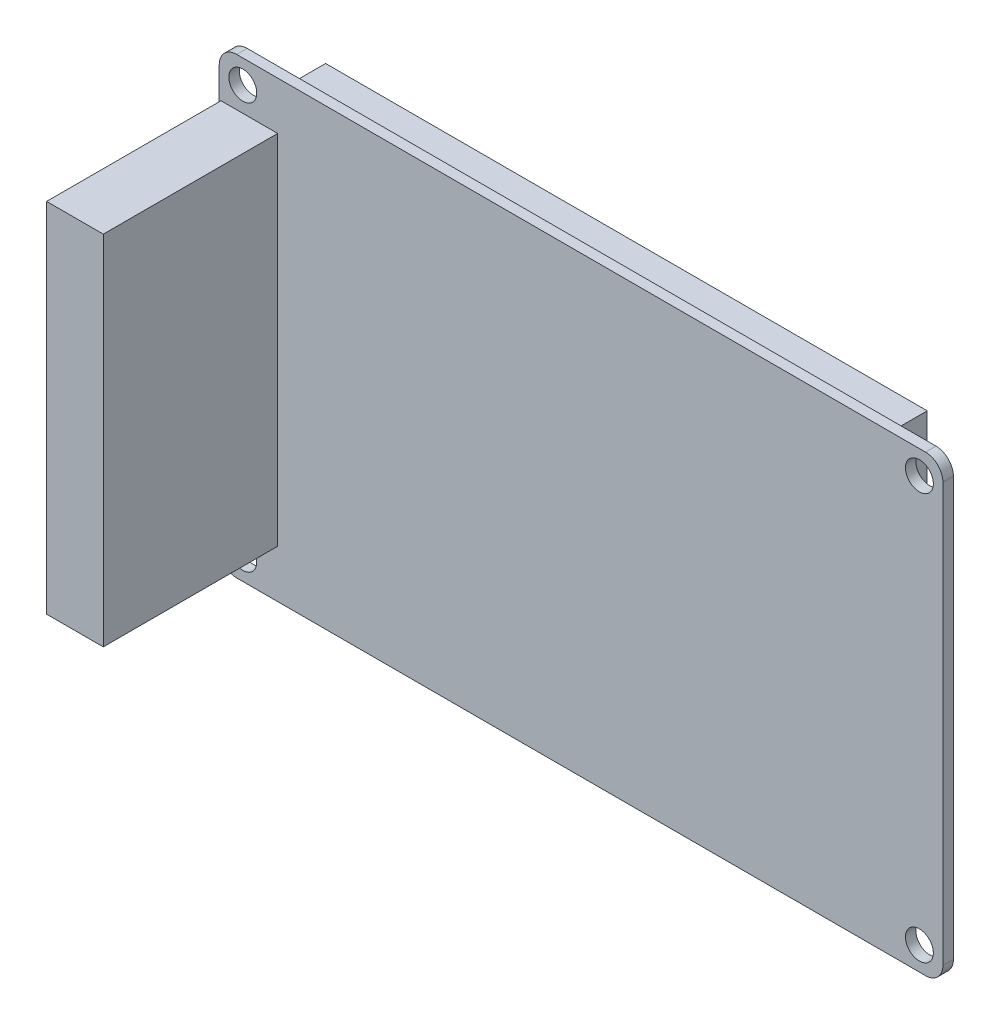
from build123d import *

# Parameters (mm, degrees)
SKETCH_1_W      = 69
SKETCH_1_H      = 50
EXTRUDE_1_DEPTH = 4
SKETCH_2_R      = 1.6
EXTRUDE_2_DEPTH = 1.2
SKETCH_3_W      = 6.5
SKETCH_3_H      = 41
EXTRUDE_3_DEPTH = 20


with BuildPart() as part:
    # 草图1 → 凸台-拉伸1 (new body)
    with BuildSketch(Plane.XY):
        with Locations((34.5, 25)):
            Rectangle(SKETCH_1_W, SKETCH_1_H)
    extrude(amount=EXTRUDE_1_DEPTH)

    # 草图2 → 凸台-拉伸2 (add)
    with BuildSketch(Plane.XY.offset(4)):
        with BuildLine():
            Line((-5, 51), (74, 51))
            ThreePointArc((74, 51), (75.414213562, 50.414213562), (76, 49))
            Line((76, 49), (76, 1))
            ThreePointArc((76, 1), (75.414213562, -0.414213562), (74, -1))
            Line((74, -1), (-5, -1))
            ThreePointArc((-5, -1), (-6.414213562, -0.414213562), (-7, 1))
            Line((-7, 1), (-7, 49))
            ThreePointArc((-7, 49), (-6.414213562, 50.414213562), (-5, 51))
        make_face()
        with Locations((-4.3, 48.3)):
            Circle(SKETCH_2_R, mode=Mode.SUBTRACT)
        with Locations((73.3, 48.3)):
            Circle(SKETCH_2_R, mode=Mode.SUBTRACT)
        with Locations((-4.3, 1.7)):
            Circle(SKETCH_2_R, mode=Mode.SUBTRACT)
        with Locations((73.3, 1.7)):
            Circle(SKETCH_2_R, mode=Mode.SUBTRACT)
    extrude(amount=EXTRUDE_2_DEPTH)

    # 草图3 → 凸台-拉伸3 (add)
    with BuildSketch(Plane.XY.offset(5.2)):
        with Locations((-3.55, 25)):
            Rectangle(SKETCH_3_W, SKETCH_3_H)
    extrude(amount=EXTRUDE_3_DEPTH)


solid = part.part
